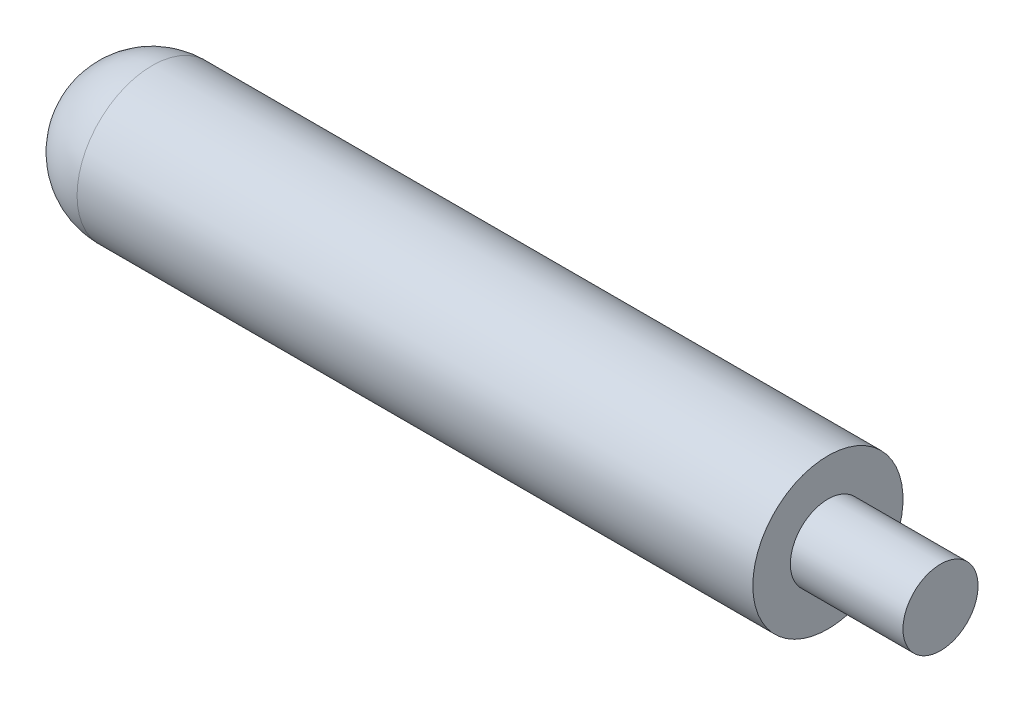
from build123d import *


with BuildPart() as part:
    # Sketch2 → Revolve1 (revolve)
    with BuildSketch(Plane.XY):
        with BuildLine():
            Line((0, 0), (146.05, 0))
            Line((146.05, 0), (146.05, 6.35))
            Line((146.05, 6.35), (127, 6.35))
            Line((127, 6.35), (127, 12.7))
            Line((127, 12.7), (12.7, 12.7))
            ThreePointArc((12.7, 12.7), (3.719743879, 8.980256121), (0, 0))
        make_face()
    revolve(axis=Axis((0, 0, 0), (1, 0, 0)))


solid = part.part
